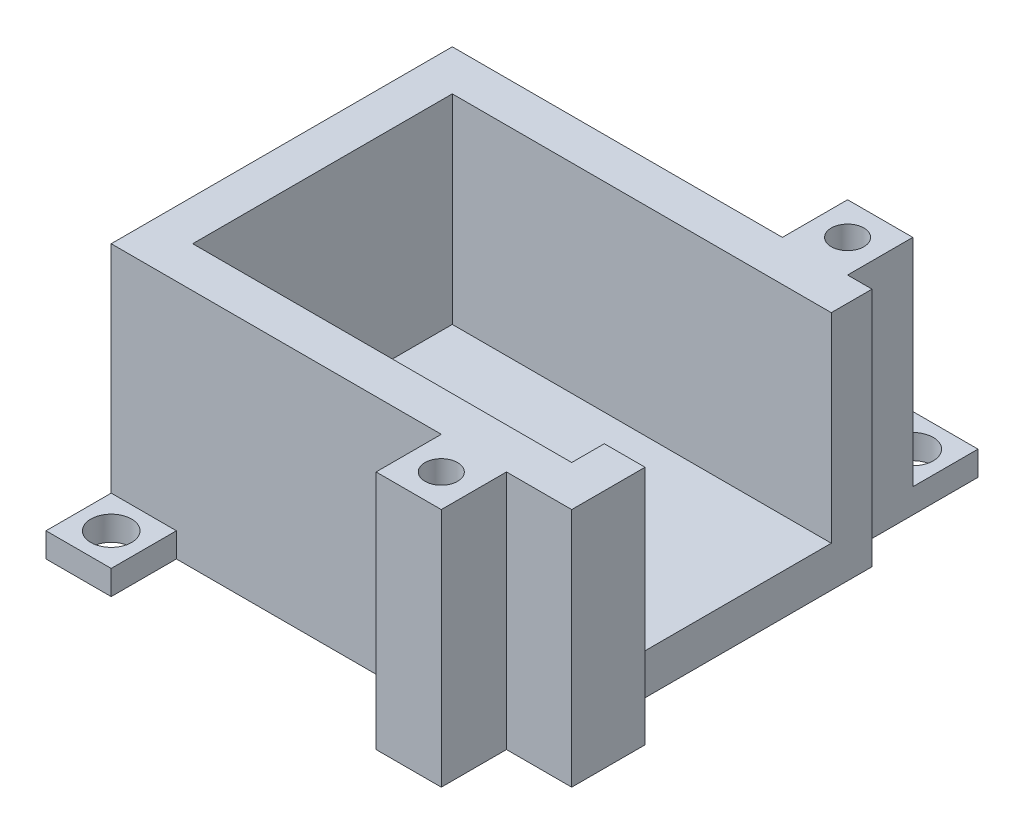
from build123d import *

# Parameters (mm, degrees)
BOSS_EXTRUDE1_DEPTH = 24.5
SKETCH2_W           = 103
SKETCH2_H           = 41.85
BOSS_EXTRUDE2_DEPTH = 5
SKETCH3_W           = 46.5
SKETCH3_H           = 27.85
CUT_EXTRUDE1_DEPTH  = 26
SKETCH7_W           = 8
SKETCH7_H           = 3
BOSS_EXTRUDE3_DEPTH = 8
SKETCH8_R           = 2.5
CUT_EXTRUDE2_DEPTH  = 8
SKETCH9_W           = 8
SKETCH9_H           = 3
BOSS_EXTRUDE4_DEPTH = 8
SKETCH10_R          = 2.5
CUT_EXTRUDE3_DEPTH  = 8
SKETCH12_W          = 11.5
SKETCH12_H          = 5
CUT_EXTRUDE4_DEPTH  = 8
SKETCH14_W          = 8
SKETCH14_H          = 3
BOSS_EXTRUDE5_DEPTH = 8
SKETCH15_R          = 2.5
CUT_EXTRUDE5_DEPTH  = 8
SKETCH16_W          = 8
SKETCH16_H          = 29.5
BOSS_EXTRUDE6_DEPTH = 8
SKETCH17_W          = 8
SKETCH17_H          = 29.5
BOSS_EXTRUDE7_DEPTH = 8
SKETCH18_R          = 2
CUT_EXTRUDE6_DEPTH  = 10
SKETCH20_W          = 8
SKETCH20_H          = 3
BOSS_EXTRUDE8_DEPTH = 8
SKETCH21_R          = 2.5
CUT_EXTRUDE7_DEPTH  = 8
SKETCH22_W          = 5
SKETCH22_H          = 5
CUT_EXTRUDE8_DEPTH  = 8
SKETCH23_W          = 27
SKETCH23_H          = 5
CUT_EXTRUDE9_DEPTH  = 8


with BuildPart() as part:
    # Sketch1 → Boss-Extrude1 (new body)
    with BuildSketch(Plane(origin=(0, 0, 0), x_dir=(1, 0, 0), z_dir=(0, 1, 0))):
        Polygon((0, 0), (51.5, 0), (51.5, -5), (5, -5), (5, -36.85), (51.5, -36.85), (51.5, -32.85), (56.5, -32.85), (56.5, -41.85), (0, -41.85), align=None)
    extrude(amount=BOSS_EXTRUDE1_DEPTH)

    # Sketch2 → Boss-Extrude2 (add)
    with BuildSketch(Plane.XZ):
        with Locations((51.5, 20.925)):
            Rectangle(SKETCH2_W, SKETCH2_H)
    extrude(amount=BOSS_EXTRUDE2_DEPTH)

    # Sketch3 → Cut-Extrude1 (cut)
    with BuildSketch(Plane(origin=(0, 0, 0), x_dir=(1, 0, 0), z_dir=(0, 1, 0))):
        with Locations((74.75, -18.925)):
            Rectangle(SKETCH3_W, SKETCH3_H)
    extrude(amount=-CUT_EXTRUDE1_DEPTH, mode=Mode.SUBTRACT)

    # Sketch7 → Boss-Extrude3 (add)
    with BuildSketch(Plane.XY.offset(41.85)):
        with Locations((4, -3.5)):
            Rectangle(SKETCH7_W, SKETCH7_H)
    extrude(amount=BOSS_EXTRUDE3_DEPTH)

    # Sketch8 → Cut-Extrude2 (cut)
    with BuildSketch(Plane(origin=(0, -2, 0), x_dir=(1, 0, 0), z_dir=(0, 1, 0))):
        with Locations(Location((4, -45.85, 0), (0, 0, 270))):
            Circle(SKETCH8_R)
    extrude(amount=-CUT_EXTRUDE2_DEPTH, mode=Mode.SUBTRACT)

    # Sketch9 → Boss-Extrude4 (add)
    with BuildSketch(Plane(origin=(0, 0, 0), x_dir=(-1, 0, 0), z_dir=(0, 0, -1))):
        with Locations((-99, -3.5)):
            Rectangle(SKETCH9_W, SKETCH9_H)
    extrude(amount=BOSS_EXTRUDE4_DEPTH)

    # Sketch10 → Cut-Extrude3 (cut)
    with BuildSketch(Plane(origin=(0, -2, 0), x_dir=(1, 0, 0), z_dir=(0, 1, 0))):
        with Locations(Location((99, 3.996680608, 0), (0, 0, 270))):
            Circle(SKETCH10_R)
    extrude(amount=-CUT_EXTRUDE3_DEPTH, mode=Mode.SUBTRACT)

    # Sketch12 → Cut-Extrude4 (cut)
    with BuildSketch(Plane(origin=(0, 0, 0), x_dir=(1, 0, 0), z_dir=(0, 1, 0))):
        with Locations((89.25, -2.5)):
            Rectangle(SKETCH12_W, SKETCH12_H)
    extrude(amount=-CUT_EXTRUDE4_DEPTH, mode=Mode.SUBTRACT)

    # Sketch14 → Boss-Extrude5 (add)
    with BuildSketch(Plane(origin=(0, 0, 0), x_dir=(-1, 0, 0), z_dir=(0, 0, -1))):
        with Locations((-79.5, -3.5)):
            Rectangle(SKETCH14_W, SKETCH14_H)
    extrude(amount=BOSS_EXTRUDE5_DEPTH)

    # Sketch15 → Cut-Extrude5 (cut)
    with BuildSketch(Plane(origin=(0, -2, 0), x_dir=(1, 0, 0), z_dir=(0, 1, 0))):
        with Locations(Location((79.5, 4, 0), (0, 0, 270))):
            Circle(SKETCH15_R)
    extrude(amount=-CUT_EXTRUDE5_DEPTH, mode=Mode.SUBTRACT)

    # Sketch16 → Boss-Extrude6 (add)
    with BuildSketch(Plane(origin=(0, 0, 0), x_dir=(-1, 0, 0), z_dir=(0, 0, -1))):
        with Locations((-44.5, 9.75)):
            Rectangle(SKETCH16_W, SKETCH16_H)
    extrude(amount=BOSS_EXTRUDE6_DEPTH)

    # Sketch17 → Boss-Extrude7 (add)
    with BuildSketch(Plane.XY.offset(41.85)):
        with Locations((44.5, 9.75)):
            Rectangle(SKETCH17_W, SKETCH17_H)
    extrude(amount=BOSS_EXTRUDE7_DEPTH)

    # Sketch18 → Cut-Extrude6 (cut)
    with BuildSketch(Plane(origin=(0, 24.5, 0), x_dir=(1, 0, 0), z_dir=(0, 1, 0))):
        with Locations(Location((44.5, 4, 0), (0, 0, 270))):
            Circle(SKETCH18_R)
        with Locations(Location((44.5, -45.85, 0), (0, 0, 270))):
            Circle(SKETCH18_R)
    extrude(amount=-CUT_EXTRUDE6_DEPTH, mode=Mode.SUBTRACT)

    # Sketch20 → Boss-Extrude8 (add)
    with BuildSketch(Plane(origin=(0, 0, -8), x_dir=(-1, 0, 0), z_dir=(0, 0, -1))):
        with Locations((-44.5, -3.5)):
            Rectangle(SKETCH20_W, SKETCH20_H)
    extrude(amount=BOSS_EXTRUDE8_DEPTH)

    # Sketch21 → Cut-Extrude7 (cut)
    with BuildSketch(Plane(origin=(0, -2, 0), x_dir=(1, 0, 0), z_dir=(0, 1, 0))):
        with Locations(Location((44.5, 12, 0), (0, 0, 180))):
            Circle(SKETCH21_R)
    extrude(amount=-CUT_EXTRUDE7_DEPTH, mode=Mode.SUBTRACT)

    # Sketch22 → Cut-Extrude8 (cut)
    with BuildSketch(Plane(origin=(0, 0, 0), x_dir=(1, 0, 0), z_dir=(0, 1, 0))):
        Polygon((103, -41.85), (103, 8), (56.5, 8), (56.5, 0), (83.5, 0), (83.5, -5), (56.5, -5), (56.5, -41.85), align=None)
        with Locations((54, -2.5)):
            Rectangle(SKETCH22_W, SKETCH22_H)
    extrude(amount=-CUT_EXTRUDE8_DEPTH, mode=Mode.SUBTRACT)


with BuildPart() as cut_extrude8_piece_1:
    # of the separate pieces the step leaves, piece 1, a body of its own (cut_extrude8_pieces)
    add(part.part.solids().sort_by_distance((51.5, 24.5, 0))[0])


with BuildPart() as cut_extrude8_piece_2:
    # of the separate pieces the step leaves, piece 2, a body of its own (cut_extrude8_pieces)
    add(part.part.solids().sort_by_distance((83.5, 0, 0))[0])

    # Sketch23 → Cut-Extrude9 (cut)
    with BuildSketch(Plane(origin=(0, 0, 0), x_dir=(1, 0, 0), z_dir=(0, 1, 0))):
        with Locations((70, -2.5)):
            Rectangle(SKETCH23_W, SKETCH23_H)
    extrude(amount=-CUT_EXTRUDE9_DEPTH, mode=Mode.SUBTRACT)


solid = cut_extrude8_piece_1.part
